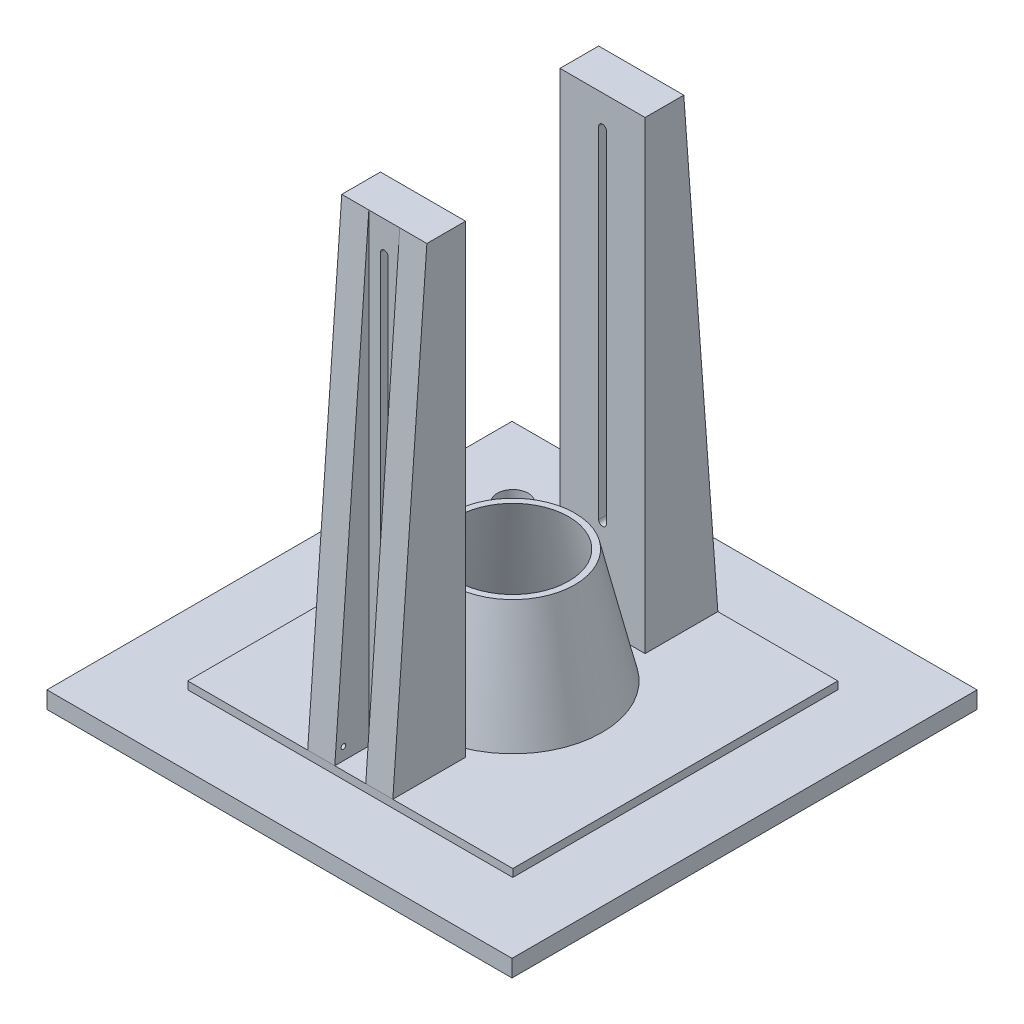
from build123d import *

# Parameters (mm, degrees)
SKETCH2_W               = 210
SKETCH2_H               = 5
BOSS_EXTRUDE1_DEPTH     = 105
SKETCH5_W               = 55.001300882
SKETCH5_H               = 25
BOSS_EXTRUDE2_DEPTH     = 300
CUT_EXTRUDE3_DEPTH      = 25
CUT_EXTRUDE4_START      = -25
CUT_EXTRUDE4_DEPTH      = 25
SKETCH8_W               = 17.5
SKETCH8_H               = 22
BOSS_EXTRUDE3_DEPTH     = 300
CUT_EXTRUDE7_DEPTH      = 345.35628352
SKETCH12_R              = 1.5
CUT_EXTRUDE8_DEPTH      = 20
SKETCH13_W              = 300.5
SKETCH13_H              = 300.5
BOSS_EXTRUDE4_DEPTH     = 11
SKETCH4_R               = 54
CUT_EXTRUDE2_DEPTH      = 20
SKETCH14_W              = 278.5
SKETCH14_H              = 278.5
SKETCH14_R              = 54
BOSS_EXTRUDE5_DEPTH     = 11
CUT_EXTRUDE9_DEPTH      = 372.921362656
CUT_EXTRUDE9_DEPTH_BACK = 372.921362656
SKETCH16_R              = 10


with BuildPart() as part:
    # Sketch1 → Revolve1 (revolve)
    with BuildSketch(Plane(origin=(0, 0, 0), x_dir=(0, 0, -1), z_dir=(1, 0, 0)), mode=Mode.PRIVATE) as revolve1_sk:
        Polygon((58, -1.164167591), (40.125, 73.835832409), (36.125, 73.835832409), (54, -1.164167591), align=None)
    revolve(revolve1_sk.sketch.rotate(Axis((0, 0, 0), (0, -1, 0)), 180), axis=Axis((0, 0, 0), (0, -1, 0)))

    # Sketch2 → Boss-Extrude1 (add, symmetric)
    with BuildSketch(Plane.XY):
        with Locations((0, -2.5)):
            Rectangle(SKETCH2_W, SKETCH2_H)
    extrude(amount=BOSS_EXTRUDE1_DEPTH, both=True)

    # Sketch5 → Boss-Extrude2 (add)
    with BuildSketch(Plane(origin=(0, 0, 0), x_dir=(1, 0, 0), z_dir=(0, 1, 0))):
        with Locations((-0.000650441, 70.5)):
            Rectangle(SKETCH5_W, SKETCH5_H)
        with Locations((-0.000650441, -70.5)):
            Rectangle(SKETCH5_W, SKETCH5_H)
    extrude(amount=BOSS_EXTRUDE2_DEPTH)

    # Sketch6 → Cut-Extrude3 (cut)
    with BuildSketch(Plane.XY.offset(83)):
        with BuildLine():
            Line((-2.5, 280), (-2.5, 60))
            ThreePointArc((-2.5, 60), (0, 57.5), (2.5, 60))
            Line((2.5, 60), (2.5, 280))
            ThreePointArc((2.5, 280), (0, 282.5), (-2.5, 280))
        make_face()
    extrude(amount=-CUT_EXTRUDE3_DEPTH, mode=Mode.SUBTRACT)

    # Sketch7 → Cut-Extrude4 (cut)
    with BuildSketch(Plane(origin=(0, 0, -83), x_dir=(-1, 0, 0), z_dir=(0, 0, -1)).offset(CUT_EXTRUDE4_START)):
        with BuildLine():
            Line((-2.5, 280), (-2.5, 60))
            ThreePointArc((-2.5, 60), (0, 57.5), (2.5, 60))
            Line((2.5, 60), (2.5, 280))
            ThreePointArc((2.5, 280), (0, 282.5), (-2.5, 280))
        make_face()
    extrude(amount=CUT_EXTRUDE4_DEPTH, mode=Mode.SUBTRACT)

    # Sketch8 → Boss-Extrude3 (add)
    with BuildSketch(Plane(origin=(0, 0, 0), x_dir=(1, 0, 0), z_dir=(0, 1, 0))):
        with Locations((18.75, -94)):
            Rectangle(SKETCH8_W, SKETCH8_H)
        with Locations((-18.751300882, 94)):
            Rectangle(SKETCH8_W, SKETCH8_H)
        with Locations((-18.751300882, -94)):
            Rectangle(SKETCH8_W, SKETCH8_H)
        with Locations((18.75, 94)):
            Rectangle(SKETCH8_W, SKETCH8_H)
    extrude(amount=BOSS_EXTRUDE3_DEPTH)

    # Sketch11 → Cut-Extrude7 (cut, through all)
    with BuildSketch(Plane(origin=(27.5, 0, 0), x_dir=(0, 0, -1), z_dir=(1, 0, 0))):
        Polygon((-105, 0), (-83, 300), (-105, 300), align=None)
        Polygon((105, 300), (105, 0), (83, 300), align=None)
    extrude(amount=-CUT_EXTRUDE7_DEPTH, mode=Mode.SUBTRACT)

    # Sketch12 → Cut-Extrude8 (cut)
    with BuildSketch(Plane.ZY.offset(27.501300882)):
        with Locations((99.399906916, 8)):
            Circle(SKETCH12_R)
    extrude(amount=-CUT_EXTRUDE8_DEPTH, mode=Mode.SUBTRACT)

    # Sketch13 → Boss-Extrude4 (add)
    with BuildSketch(Plane.XZ.offset(5)):
        with Locations((-0.25, 0.25)):
            Rectangle(SKETCH13_W, SKETCH13_H)
    extrude(amount=BOSS_EXTRUDE4_DEPTH)

    # Sketch4 → Cut-Extrude2 (cut)
    with BuildSketch(Plane(origin=(0, 0, 0), x_dir=(1, 0, 0), z_dir=(0, 1, 0))):
        with Locations(Location((0, 0, 0), (0, 0, 270))):
            Circle(SKETCH4_R)
    extrude(amount=-CUT_EXTRUDE2_DEPTH, mode=Mode.SUBTRACT)

    # Sketch14 → Boss-Extrude5 (add)
    with BuildSketch(Plane.XZ.offset(16)):
        with Locations((-0.25, 0.25)):
            Rectangle(SKETCH14_W, SKETCH14_H)
        with Locations(Location((0, 0, 0), (0, 0, 90))):
            Circle(SKETCH14_R, mode=Mode.SUBTRACT)
        Polygon((-102, 127), (-52, 77), (51.5, 77), (101.5, 127), align=None, mode=Mode.SUBTRACT)
        Polygon((-127, 102), (-77, 52), (-77, -51.5), (-127, -101.5), align=None, mode=Mode.SUBTRACT)
        Polygon((-102, -126.5), (-52.613173487, -77.113173487), (52.113173487, -77.113173487), (101.5, -126.5), align=None, mode=Mode.SUBTRACT)
        Polygon((128.205701443, 103.705701443), (128.205701443, -103.205701443), (78.205701443, -53.205701443), (78.205701443, 53.705701443), align=None, mode=Mode.SUBTRACT)
    extrude(amount=BOSS_EXTRUDE5_DEPTH)

    # Sketch16 → Cut-Extrude9 (cut, two sides: drawn at the far end of the back side and taken through both)
    with BuildSketch(Plane(origin=(0, -5, 0), x_dir=(1, 0, 0), z_dir=(0, 1, 0)).offset(-CUT_EXTRUDE9_DEPTH_BACK)):
        with Locations(Location((-105, 105, 0), (0, 0, 180))):
            Circle(SKETCH16_R)
    extrude(amount=CUT_EXTRUDE9_DEPTH + CUT_EXTRUDE9_DEPTH_BACK, mode=Mode.SUBTRACT)


solid = part.part
